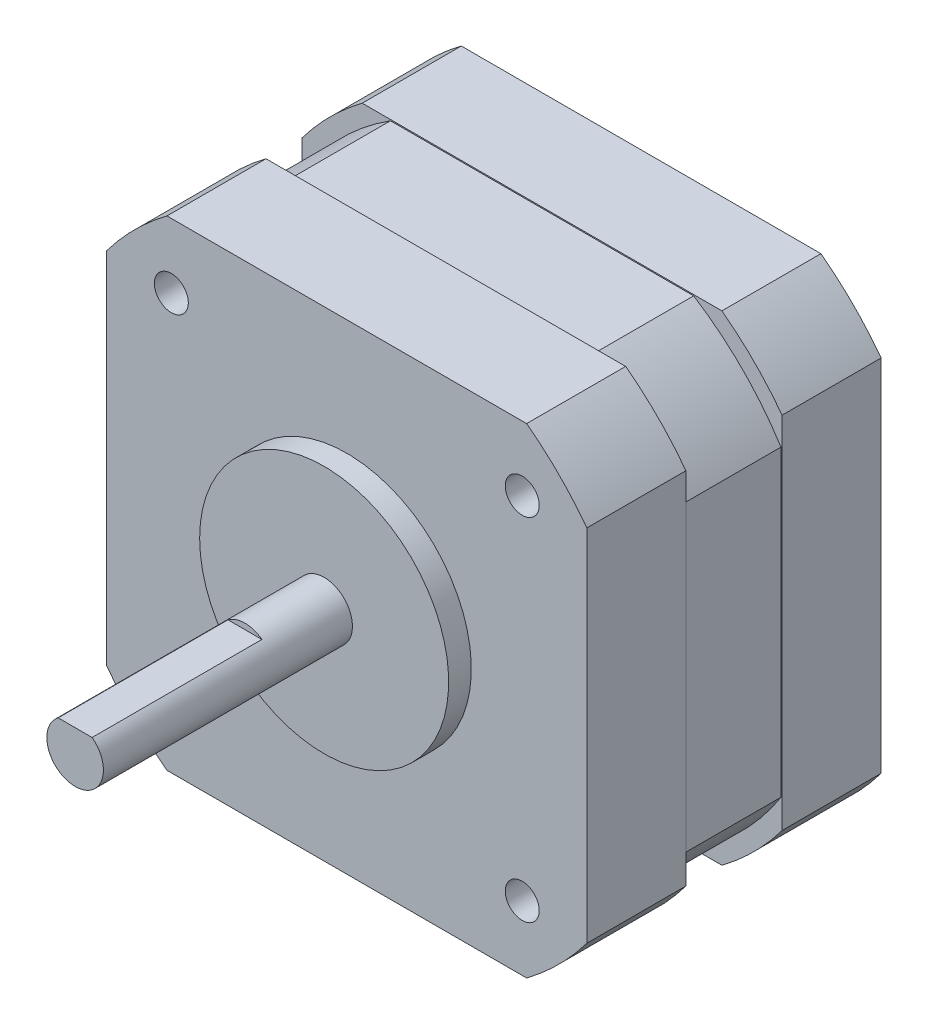
from build123d import *

# Parameters (mm, degrees)
SKETCH1_R                       = 2.5
BOSS_EXTRUDE1_DEPTH             = 24
SKETCH2_R                       = 11
BOSS_EXTRUDE2_DEPTH             = 2
SKETCH3_W                       = 42.418
SKETCH3_H                       = 42.418
BOSS_EXTRUDE3_DEPTH             = 26
CUT_EXTRUDE1_DEPTH              = 59.306460723
M3X0_5_TAPPED_HOLE1_D           = 2.5
M3X0_5_TAPPED_HOLE1_DEPTH       = 7.5
M3X0_5_TAPPED_HOLE1_CBORE_D     = 3
M3X0_5_TAPPED_HOLE1_CBORE_DEPTH = 6
M3X0_5_TAPPED_HOLE1_TIP         = 0.751075774
CUT_EXTRUDE2_START              = -15
CUT_EXTRUDE2_DEPTH              = 15
CUT_EXTRUDE3_DEPTH              = 4.25
CUT_EXTRUDE3_DEPTH_BACK         = 4.25


with BuildPart() as part:
    # Sketch1 → Boss-Extrude1 (new body)
    with BuildSketch(Plane.XY):
        Circle(SKETCH1_R)
    extrude(amount=BOSS_EXTRUDE1_DEPTH)

    # Sketch2 → Boss-Extrude2 (add)
    with BuildSketch(Plane(origin=(0, 0, 0), x_dir=(-1, 0, 0), z_dir=(0, 0, -1))):
        Circle(SKETCH2_R)
    extrude(amount=-BOSS_EXTRUDE2_DEPTH)

    # Sketch3 → Boss-Extrude3 (add)
    with BuildSketch(Plane(origin=(0, 0, 0), x_dir=(-1, 0, 0), z_dir=(0, 0, -1))):
        Rectangle(SKETCH3_W, SKETCH3_H)
    extrude(amount=BOSS_EXTRUDE3_DEPTH)

    # Sketch4 → Cut-Extrude1 (cut, through all)
    with BuildSketch(Plane(origin=(0, 0, -26), x_dir=(-1, 0, 0), z_dir=(0, 0, -1))):
        with BuildLine():
            Line((-21.209, -15.887992919), (-21.209, -21.209))
            Line((-21.209, -21.209), (-15.887992919, -21.209))
            ThreePointArc((-15.887992919, -21.209), (-18.738329701, -18.738329701), (-21.209, -15.887992919))
        make_face()
        with BuildLine():
            Line((15.887992919, -21.209), (21.209, -21.209))
            Line((21.209, -21.209), (21.209, -15.887992919))
            ThreePointArc((21.209, -15.887992919), (18.738329701, -18.738329701), (15.887992919, -21.209))
        make_face()
        with BuildLine():
            Line((21.209, 15.887992919), (21.209, 21.209))
            Line((21.209, 21.209), (15.887992919, 21.209))
            ThreePointArc((15.887992919, 21.209), (18.738329701, 18.738329701), (21.209, 15.887992919))
        make_face()
        with BuildLine():
            Line((-15.887992919, 21.209), (-21.209, 21.209))
            Line((-21.209, 21.209), (-21.209, 15.887992919))
            ThreePointArc((-21.209, 15.887992919), (-18.738329701, 18.738329701), (-15.887992919, 21.209))
        make_face()
    extrude(amount=-CUT_EXTRUDE1_DEPTH, mode=Mode.SUBTRACT)

    # M3x0.5 Tapped Hole1
    with Locations(Plane.XY):
        with Locations((-15.5, 15.5), (-15.5, -15.5), (15.5, -15.5), (15.5, 15.5)):
            CounterBoreHole(M3X0_5_TAPPED_HOLE1_D / 2, M3X0_5_TAPPED_HOLE1_CBORE_D / 2, M3X0_5_TAPPED_HOLE1_CBORE_DEPTH, depth=M3X0_5_TAPPED_HOLE1_DEPTH)
            with Locations((0, 0, -(M3X0_5_TAPPED_HOLE1_DEPTH + M3X0_5_TAPPED_HOLE1_TIP / 2))):  # 118° drill point
                Cone(0, M3X0_5_TAPPED_HOLE1_D / 2, M3X0_5_TAPPED_HOLE1_TIP, mode=Mode.SUBTRACT)

    # Sketch7 → Cut-Extrude2 (cut)
    with BuildSketch(Plane.XY.offset(24).offset(CUT_EXTRUDE2_START)):
        with BuildLine():
            Line((-1.5, 2), (1.5, 2))
            ThreePointArc((1.5, 2), (0, 2.5), (-1.5, 2))
        make_face()
    extrude(amount=CUT_EXTRUDE2_DEPTH, mode=Mode.SUBTRACT)

    # Sketch8 → Cut-Extrude3 (cut, two sides: drawn at the far end of the back side and taken through both)
    with BuildSketch(Plane.XY.offset(-13).offset(-CUT_EXTRUDE3_DEPTH_BACK)):
        with BuildLine():
            Line((15.887992919, 21.209), (-15.887992919, 21.209))
            ThreePointArc((-15.887992919, 21.209), (-18.738329701, 18.738329701), (-21.209, 15.887992919))
            Line((-21.209, 15.887992919), (-21.209, -15.887992919))
            ThreePointArc((-21.209, -15.887992919), (-18.738329701, -18.738329701), (-15.887992919, -21.209))
            Line((-15.887992919, -21.209), (15.887992919, -21.209))
            ThreePointArc((15.887992919, -21.209), (18.738329701, -18.738329701), (21.209, -15.887992919))
            Line((21.209, -15.887992919), (21.209, 15.887992919))
            ThreePointArc((21.209, 15.887992919), (18.738329701, 18.738329701), (15.887992919, 21.209))
        make_face()
        with BuildLine():
            Line((-13.394406258, 21.109), (13.394406258, 21.109))
            ThreePointArc((13.394406258, 21.109), (17.67766953, 17.67766953), (21.109, 13.394406258))
            Line((21.109, 13.394406258), (21.109, -13.394406258))
            ThreePointArc((21.109, -13.394406258), (17.67766953, -17.67766953), (13.394406258, -21.109))
            Line((13.394406258, -21.109), (-13.394406258, -21.109))
            ThreePointArc((-13.394406258, -21.109), (-17.67766953, -17.67766953), (-21.109, -13.394406258))
            Line((-21.109, -13.394406258), (-21.109, 13.394406258))
            ThreePointArc((-21.109, 13.394406258), (-17.67766953, 17.67766953), (-13.394406258, 21.109))
        make_face(mode=Mode.SUBTRACT)
    extrude(amount=CUT_EXTRUDE3_DEPTH + CUT_EXTRUDE3_DEPTH_BACK, mode=Mode.SUBTRACT)


solid = part.part
